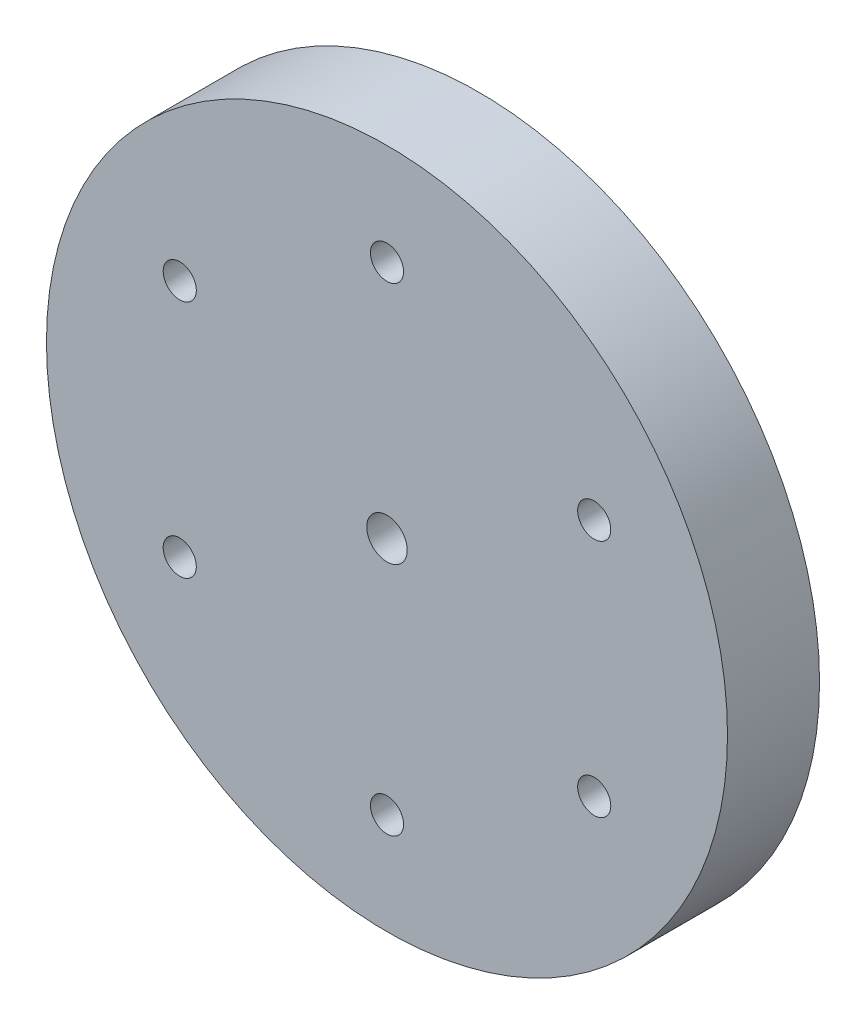
from build123d import *

# Parameters (mm, degrees)
SKETCH_1_R               = 18.5
SKETCH_1_R_2             = 1.1
EXTRUDE_1_DEPTH          = 2.5
SKETCH_2_R               = 0.9
CUT_EXTRUDE_1_DEPTH      = 27.636441204
PATTERN_CIRCULAR_1_COUNT = 6


with BuildPart() as part:
    # 草图1 → 凸台-拉伸1 (new, symmetric)
    with BuildSketch(Plane.XY):
        Circle(SKETCH_1_R)
        Circle(SKETCH_1_R_2, mode=Mode.SUBTRACT)
    extrude(amount=EXTRUDE_1_DEPTH, both=True)

    # 草图2 → 切除-拉伸1 (cut, through all)
    with BuildSketch(Plane.XY.offset(2.5)):
        with Locations((0, 13)):
            Circle(SKETCH_2_R)
    cut_extrude_1 = extrude(amount=-CUT_EXTRUDE_1_DEPTH, mode=Mode.SUBTRACT)

    # 阵列(圆周)1: 切除-拉伸1 ×6 about axis
    pattern_circular_1_axis = Axis((0, 0, 0), (0, 0, 1))
    for i in range(1, PATTERN_CIRCULAR_1_COUNT):
        add(cut_extrude_1.rotate(pattern_circular_1_axis, i * 360 / PATTERN_CIRCULAR_1_COUNT), mode=Mode.SUBTRACT)


solid = part.part
